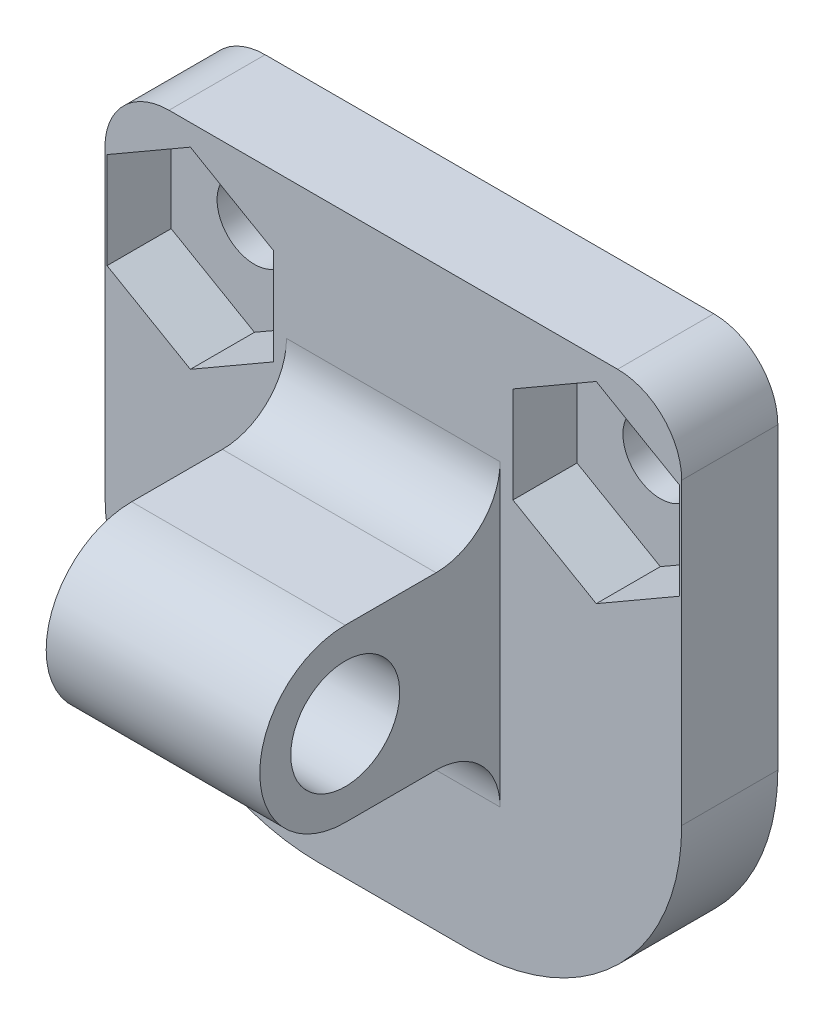
from build123d import *

# Parameters (mm, degrees)
SKETCH1_W           = 27
SKETCH1_H           = 27
SKETCH1_R           = 1.75
BOSS_EXTRUDE1_DEPTH = 4.5
SKETCH1_3_W         = 10
SKETCH1_3_H         = 8
BOSS_EXTRUDE2_DEPTH = 15.75
FILLET1_R           = 10
SKETCH2_R           = 2.55
CUT_EXTRUDE1_DEPTH  = 28.795008545
FILLET2_RADIUS      = 4
FILLET2_LENGTH      = 10
FILLET3_R           = 3
CUT_EXTRUDE2_DEPTH  = 3
FILLET6_R           = 3


with BuildPart() as part:
    # Sketch1 → Boss-Extrude1 (new body)
    with BuildSketch(Plane.XY):
        Rectangle(SKETCH1_W, SKETCH1_H)
        with Locations((-9.5, 8)):
            Circle(SKETCH1_R, mode=Mode.SUBTRACT)
        with Locations((9.5, 8)):
            Circle(SKETCH1_R, mode=Mode.SUBTRACT)
    extrude(amount=BOSS_EXTRUDE1_DEPTH)

    # Sketch1<3> → Boss-Extrude2 (add)
    with BuildSketch(Plane.XY):
        Rectangle(SKETCH1_3_W, SKETCH1_3_H)
    extrude(amount=BOSS_EXTRUDE2_DEPTH)

    # Fillet1
    fillet1_edges = [part.edges().sort_by_distance(p)[0] for p in [
        (-13.5, -13.5, 2.25),
        (13.5, -13.5, 2.25),
    ]]
    fillet(fillet1_edges, radius=FILLET1_R)

    # Sketch2 → Cut-Extrude1 (cut, through all)
    with BuildSketch(Plane.ZY.offset(5)):
        with Locations((11.75, 0)):
            Circle(SKETCH2_R)
    extrude(amount=-CUT_EXTRUDE1_DEPTH, mode=Mode.SUBTRACT)

    # Fillet2: full round fillet: the end face becomes a half cylinder, R = half its width
    fillet2_face = Plane((0, 0, 15.75), x_dir=(-1, 0, 0), z_dir=(0, 0, 1))  # on the end face: x along it, z out of the body
    fillet2_slab = fillet2_face.offset(-FILLET2_RADIUS / 2) * Box(FILLET2_LENGTH, 2 * FILLET2_RADIUS, FILLET2_RADIUS, mode=Mode.PRIVATE)  # the body's end, R deep
    fillet2_round = Plane((0, 0, 11.75), x_dir=(0, 0, 1), z_dir=(-1, 0, 0)) * Cylinder(FILLET2_RADIUS, FILLET2_LENGTH, mode=Mode.PRIVATE)  # its axis R under the face
    add(fillet2_slab - fillet2_round, mode=Mode.SUBTRACT)

    # Fillet3
    fillet3_edges = [part.edges().sort_by_distance(p)[0] for p in [
        (0, -4, 4.5),
        (0, 4, 4.5),
    ]]
    fillet(fillet3_edges, radius=FILLET3_R)

    # Sketch3 → Cut-Extrude2 (cut)
    with BuildSketch(Plane.XY.offset(4.5)):
        Polygon((-9.5, 12.5033321), (-13.4, 10.25166605), (-13.4, 5.74833395), (-9.5, 3.4966679), (-5.6, 5.74833395), (-5.6, 10.25166605), align=None)
        Polygon((5.6, 10.25166605), (9.5, 12.5033321), (13.4, 10.25166605), (13.4, 5.74833395), (9.5, 3.4966679), (5.6, 5.74833395), align=None)
    extrude(amount=-CUT_EXTRUDE2_DEPTH, mode=Mode.SUBTRACT)

    # Fillet6
    fillet6_edges = [part.edges().sort_by_distance(p)[0] for p in [
        (-13.5, 13.5, 2.25),
        (13.5, 13.5, 2.25),
    ]]
    fillet(fillet6_edges, radius=FILLET6_R)


solid = part.part
